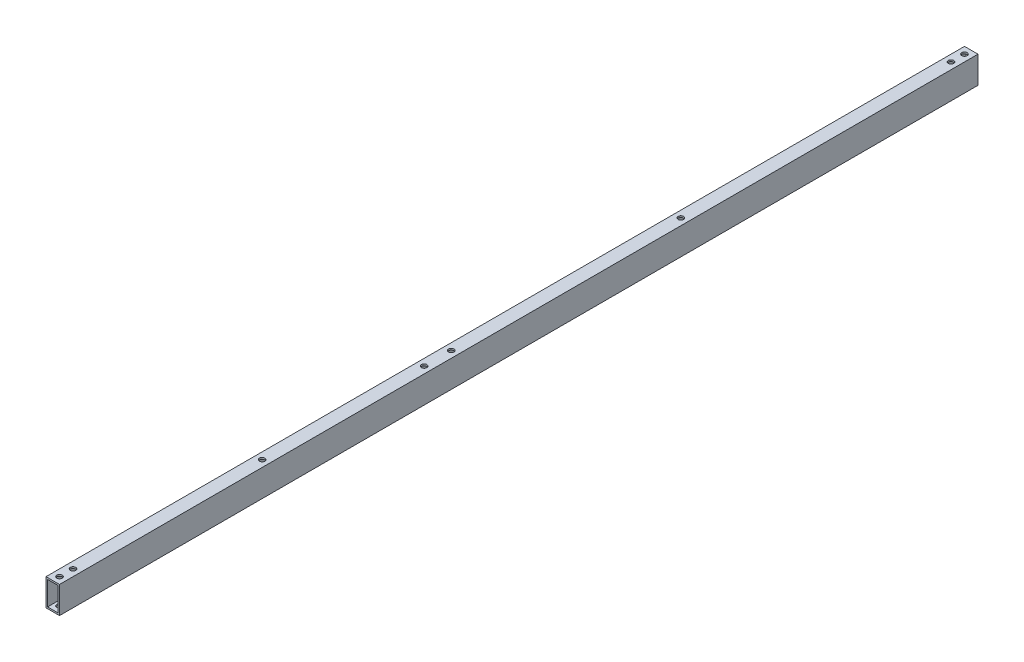
from build123d import *

# Parameters (mm, degrees)
SKETCH_1_W          = 10
SKETCH_1_H          = 20
SKETCH_1_W_2        = 7.6
SKETCH_1_H_2        = 17.6
EXTRUDE_1_DEPTH     = 680
SKETCH_2_R          = 2
CUT_EXTRUDE_1_DEPTH = 681.312428227


with BuildPart() as part:
    # ｽｹｯﾁ1 → 押し出し-薄板1 (new body)
    with BuildSketch(Plane.XY):
        Rectangle(SKETCH_1_W, SKETCH_1_H)
        Rectangle(SKETCH_1_W_2, SKETCH_1_H_2, mode=Mode.SUBTRACT)
    extrude(amount=EXTRUDE_1_DEPTH)

    # ｽｹｯﾁ2 → ｶｯﾄ - 押し出し1 (cut, through all)
    with BuildSketch(Plane(origin=(0, 10, 0), x_dir=(1, 0, 0), z_dir=(0, 1, 0))):
        with Locations(Location((0, -665, 0), (0, 0, 270))):
            Circle(SKETCH_2_R)
        with Locations(Location((0, -675, 0), (0, 0, 270))):
            Circle(SKETCH_2_R)
        with Locations(Location((0, -5, 0), (0, 0, 270))):
            Circle(SKETCH_2_R)
        with Locations(Location((0, -15, 0), (0, 0, 270))):
            Circle(SKETCH_2_R)
        with Locations(Location((0, -525, 0), (0, 0, 270))):
            Circle(SKETCH_2_R)
        with Locations(Location((0, -405, 0), (0, 0, 270))):
            Circle(SKETCH_2_R)
        with Locations(Location((0, -215, 0), (0, 0, 270))):
            Circle(SKETCH_2_R)
        with Locations(Location((0, -385, 0), (0, 0, 270))):
            Circle(SKETCH_2_R)
    extrude(amount=-CUT_EXTRUDE_1_DEPTH, mode=Mode.SUBTRACT)


solid = part.part
